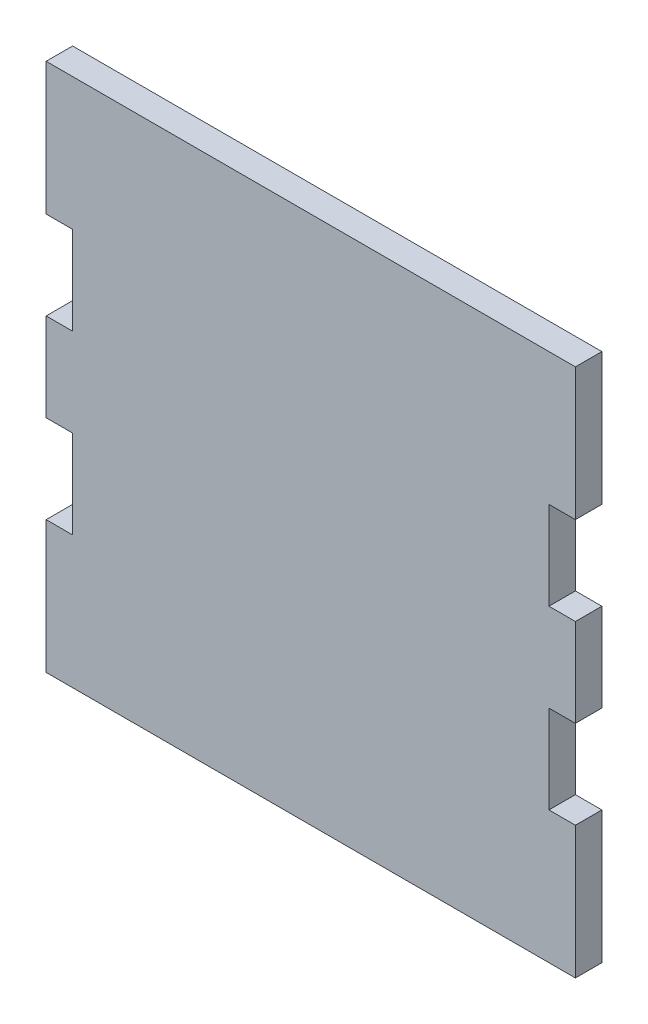
from build123d import *

# Parameters (mm, degrees)
BOSS_EXTRUDE1_DEPTH = 3


with BuildPart() as part:
    # Sketch1 → Boss-Extrude1 (new body)
    with BuildSketch(Plane.XY):
        Polygon((30, 15), (30, 30), (27, 30), (-30, 30), (-30, 15), (-27, 15), (-27, 5), (-30, 5), (-30, -5), (-27, -5), (-27, -15), (-30, -15), (-30, -30), (27, -30), (30, -30), (30, -15), (27, -15), (27, -5), (30, -5), (30, 5), (27, 5), (27, 15), align=None)
    extrude(amount=BOSS_EXTRUDE1_DEPTH)


solid = part.part
